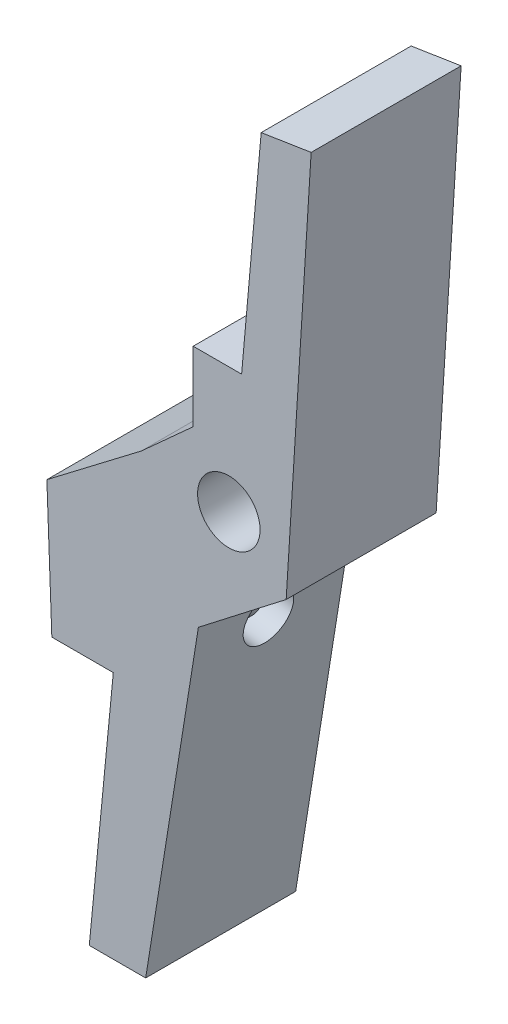
from build123d import *

# Parameters (mm, degrees)
SKETCH_1_R          = 2.5
EXTRUDE_1_DEPTH     = 12
SKETCH_2_R          = 2
CUT_EXTRUDE_1_DEPTH = 5
SKETCH_3_R          = 1.5
EXTRUDE_2_DEPTH     = 4
FILLET_1_R          = 1.5


with BuildPart() as part:
    # 스케치1 → 보스-돌출1 (new body)
    with BuildSketch(Plane.XY):
        Polygon((6.588838908, 28.19675948), (4.588838908, -3.787132496), (-2.435084758, -9.224887606), (-6.651746097, -35.634279915), (-11.1649155, -35.634279915), (-9.242889687, -15.767948861), (-14.161167405, -15.767948861), (-14.558519827, -5.05323729), (-7, 0.71086224), (-2.849537727, 4.46912262), (-2.849537727, 10.047291676), (1.024768486, 10.047291676), (2.588838908, 27.569044976), align=None)
        Circle(SKETCH_1_R, mode=Mode.SUBTRACT)
    extrude(amount=EXTRUDE_1_DEPTH)

    # 스케치2 → 컷-돌출1 (cut)
    with BuildSketch(Plane(origin=(-0.938271737, 0.14980936, 0), x_dir=(0, 0, -1), z_dir=(0.9874921543617721, -0.1576681485714416, 0))):
        with Locations(Location((-6, -11.993439441, 0), (0, 0, 90))):
            Circle(SKETCH_2_R)
    extrude(amount=-CUT_EXTRUDE_1_DEPTH, mode=Mode.SUBTRACT)

    # 스케치3 → 보스-돌출2 (add)
    with BuildSketch(Plane(origin=(-5.875732509, 0.938150103, 0), x_dir=(0, 0, -1), z_dir=(0.9874921543617721, -0.1576681485714416, 0))):
        with Locations(Location((-6, -11.993439441, 0), (0, 0, 90))):
            Circle(SKETCH_3_R)
    extrude(amount=EXTRUDE_2_DEPTH)

    # 필렛1
    fillet_1_edges = [part.edges().sort_by_distance(p)[0] for p in [
        (-4.053249506, -13.017188075, 6),
    ]]
    fillet(fillet_1_edges, radius=FILLET_1_R)


solid = part.part
